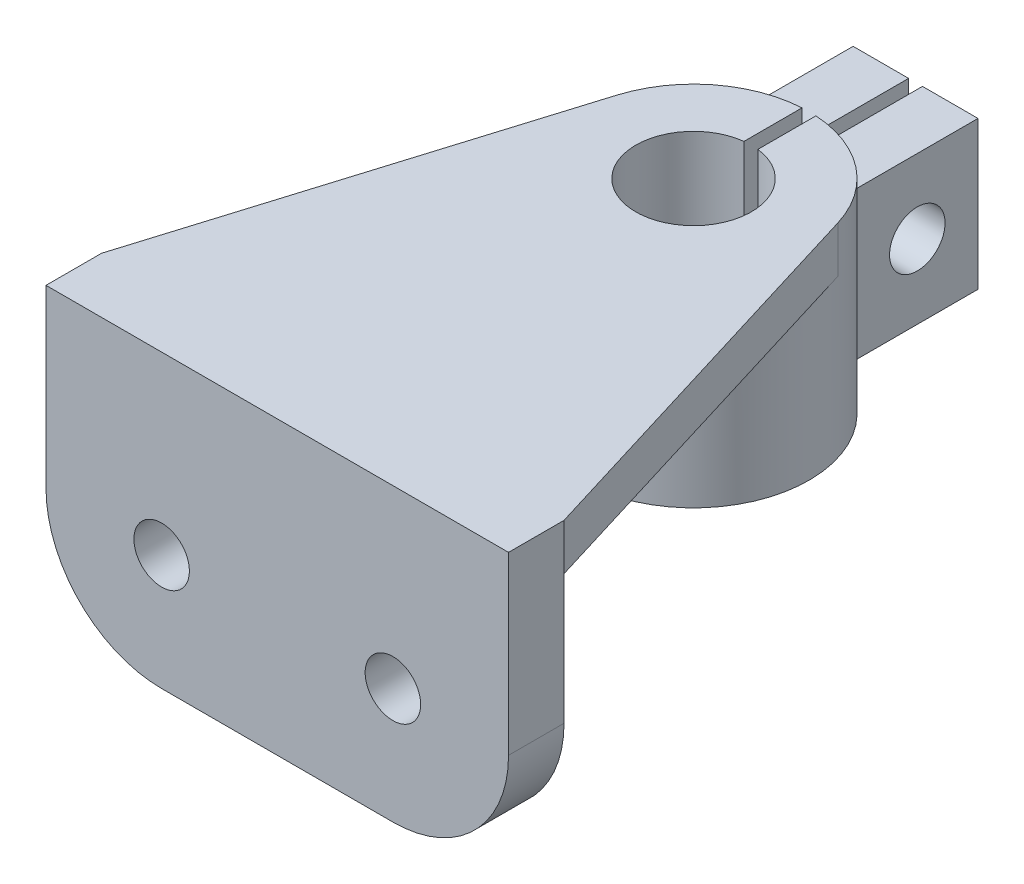
from build123d import *

# Parameters (mm, degrees)
BOSS_EXTRUDE1_DEPTH      = 12
SKETCH3_R                = 6
CUT_EXTRUDE1_DEPTH       = 12
BOSS_EXTRUDE2_DEPTH      = 10
SKETCH4_3_R              = 25
BOSS_EXTRUDE3_DEPTH      = 44
SKETCH6_R                = 12.5
CUT_EXTRUDE2_DEPTH       = 44
BOSS_EXTRUDE4_REACH      = 152.121
SKETCH7_W                = 27
SKETCH7_H                = 32
CUT_EXTRUDE3_DEPTH       = 143.520174011
CUT_EXTRUDE3_DEPTH_BACK  = 44
SKETCH8_W                = 3
SKETCH8_H                = 53.670936702
SKETCH9_R                = 6
CUT_EXTRUDE4_DEPTH       = 44
BOSS_EXTRUDE8_DEPTH      = 2.5
BOSS_EXTRUDE9_REACH      = 95.922
BOSS_EXTRUDE9_END_RADIUS = 25
SKETCH11_W               = 5
SKETCH11_H               = 34


with BuildPart() as part:
    # Sketch1 → Boss-Extrude1 (new body)
    with BuildSketch(Plane.XY):
        with BuildLine():
            Line((25, -31.5), (-25, -31.5))
            ThreePointArc((-25, -31.5), (-42.67766953, -24.17766953), (-50, -6.5))
            Line((-50, -6.5), (-50, 31.5))
            Line((-50, 31.5), (50, 31.5))
            Line((50, 31.5), (50, -6.5))
            ThreePointArc((50, -6.5), (42.67766953, -24.17766953), (25, -31.5))
        make_face()
    extrude(amount=BOSS_EXTRUDE1_DEPTH)

    # Sketch3 → Cut-Extrude1 (cut)
    with BuildSketch(Plane.XY.offset(12)):
        with Locations((-25, -6.5)):
            Circle(SKETCH3_R)
        with Locations((25, -6.5)):
            Circle(SKETCH3_R)
    extrude(amount=-CUT_EXTRUDE1_DEPTH, mode=Mode.SUBTRACT)

    # Sketch4 → Boss-Extrude2 (add)
    with BuildSketch(Plane(origin=(0, 31.5, 0), x_dir=(1, 0, 0), z_dir=(0, 1, 0))):
        with BuildLine():
            Line((-50, 0), (50, 0))
            Line((50, 0), (23.906779363, 85.312038053))
            ThreePointArc((23.906779363, 85.312038053), (0, 103), (-23.906779363, 85.312038053))
            Line((-23.906779363, 85.312038053), (-50, 0))
        make_face()
    extrude(amount=-BOSS_EXTRUDE2_DEPTH)

    # Sketch4<3> → Boss-Extrude3 (add)
    with BuildSketch(Plane(origin=(0, 31.5, 0), x_dir=(1, 0, 0), z_dir=(0, 1, 0))):
        with Locations((0, 78)):
            Circle(SKETCH4_3_R)
    extrude(amount=-BOSS_EXTRUDE3_DEPTH)

    # Sketch6 → Cut-Extrude2 (cut)
    with BuildSketch(Plane.XZ.offset(12.5)):
        with Locations((0, -78)):
            Circle(SKETCH6_R)
    extrude(amount=-CUT_EXTRUDE2_DEPTH, mode=Mode.SUBTRACT)

    # Sketch7 → Boss-Extrude4 (add, up to next)
    with BuildSketch(Plane(origin=(0, 0, -126), x_dir=(-1, 0, 0), z_dir=(0, 0, -1)), mode=Mode.PRIVATE) as boss_extrude4_sk1:
        with Locations((0, 9.5)):
            Rectangle(SKETCH7_W, SKETCH7_H)
    boss_extrude4_tool1 = extrude(boss_extrude4_sk1.sketch, amount=-BOSS_EXTRUDE4_REACH, mode=Mode.PRIVATE) - part.part
    add(boss_extrude4_tool1.solids().sort_by_distance((0, 9.5, -126))[0])

    # Sketch8 → Cut-Extrude3 (cut, two sides: drawn at the far end of the back side and taken through both)
    with BuildSketch(Plane.XZ.offset(12.5).offset(-CUT_EXTRUDE3_DEPTH_BACK)):
        with Locations((0, -99.480094591)):
            Rectangle(SKETCH8_W, SKETCH8_H)
    extrude(amount=CUT_EXTRUDE3_DEPTH + CUT_EXTRUDE3_DEPTH_BACK, mode=Mode.SUBTRACT)

    # Sketch9 → Cut-Extrude4 (cut)
    with BuildSketch(Plane.ZY.offset(13.5)):
        with Locations((-112.874414164, 9.5)):
            Circle(SKETCH9_R)
    extrude(amount=-CUT_EXTRUDE4_DEPTH, mode=Mode.SUBTRACT)



with BuildPart() as body_2:
    # Sketch10 → Boss-Extrude8 (new, symmetric)
    with BuildSketch(Plane(origin=(0, 0, 0), x_dir=(0, 0, -1), z_dir=(1, 0, 0))):
        Polygon((53, -12.5), (0, -31.5), (0, 21.5), (53, 21.5), align=None)
    extrude(amount=BOSS_EXTRUDE8_DEPTH, both=True)


with BuildPart() as part_1:
    add(part.part)

    add(body_2.part)  # Boss-Extrude9 merges body 2
    # Boss-Extrude9: up to this cylinder (the profile starts outside it)
    boss_extrude9_end = Plane(origin=(0, 4.5, -78), z_dir=(0, 1, 0)) * Cylinder(BOSS_EXTRUDE9_END_RADIUS, 242.844, mode=Mode.PRIVATE)
    # Sketch11 → Boss-Extrude9 (add, up to the surface)
    with BuildSketch(Plane(origin=(0, 0, -53), x_dir=(-1, 0, 0), z_dir=(0, 0, -1)), mode=Mode.PRIVATE) as boss_extrude9_sk1:
        with Locations((0, 4.5)):
            Rectangle(SKETCH11_W, SKETCH11_H)
    boss_extrude9_tool1 = extrude(boss_extrude9_sk1.sketch, amount=BOSS_EXTRUDE9_REACH, mode=Mode.PRIVATE) - boss_extrude9_end
    add(boss_extrude9_tool1.solids().sort_by_distance((0, 4.5, -53))[0])
    add(boss_extrude9_tool1.solids().sort_by_distance((0, 4.5, -53))[1])


solid = part_1.part
